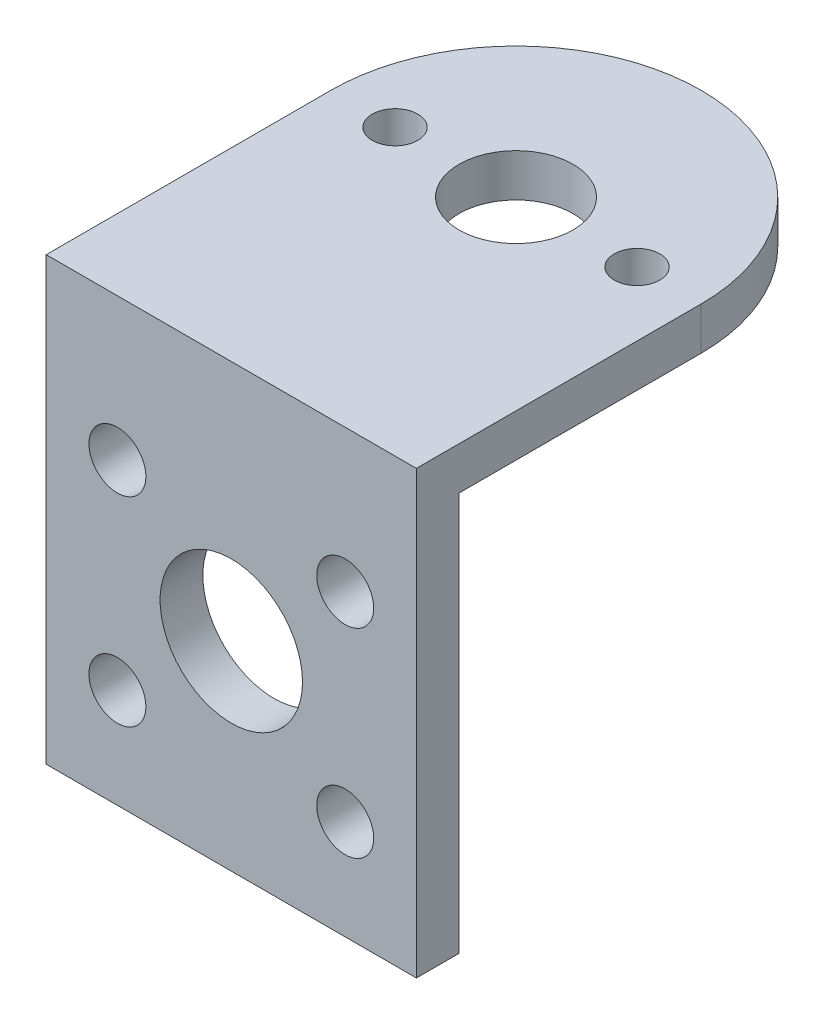
from build123d import *

# Parameters (mm, degrees)
SKETCH_1_R      = 4
SKETCH_1_R_2    = 1.6
EXTRUDE_1_DEPTH = 3
SKETCH_3_W      = 26
SKETCH_3_H      = 31
SKETCH_3_R      = 5
SKETCH_3_R_2    = 2
EXTRUDE_2_DEPTH = 3


with BuildPart() as part:
    # 草图1 → 凸台-拉伸1 (new body)
    with BuildSketch(Plane(origin=(0, 0, 0), x_dir=(1, 0, 0), z_dir=(0, 1, 0))):
        with BuildLine():
            Line((-13, 0), (-13, -20))
            Line((-13, -20), (13, -20))
            Line((13, -20), (13, 0))
            ThreePointArc((13, 0), (0, 13), (-13, 0))
        make_face()
        with Locations(Location((0, 0, 0), (0, 0, 270))):
            Circle(SKETCH_1_R, mode=Mode.SUBTRACT)
        with Locations(Location((-8.5, 0, 0), (0, 0, 270))):
            Circle(SKETCH_1_R_2, mode=Mode.SUBTRACT)
        with Locations(Location((8.5, 0, 0), (0, 0, 270))):
            Circle(SKETCH_1_R_2, mode=Mode.SUBTRACT)
    extrude(amount=EXTRUDE_1_DEPTH)

    # 草图3 → 凸台-拉伸2 (add)
    with BuildSketch(Plane.XY.offset(20)):
        with Locations((0, -12.5)):
            Rectangle(SKETCH_3_W, SKETCH_3_H)
        with Locations((0, -14)):
            Circle(SKETCH_3_R, mode=Mode.SUBTRACT)
        with Locations((-8, -7)):
            Circle(SKETCH_3_R_2, mode=Mode.SUBTRACT)
        with Locations((8, -7)):
            Circle(SKETCH_3_R_2, mode=Mode.SUBTRACT)
        with Locations((8, -21)):
            Circle(SKETCH_3_R_2, mode=Mode.SUBTRACT)
        with Locations((-8, -21)):
            Circle(SKETCH_3_R_2, mode=Mode.SUBTRACT)
    extrude(amount=-EXTRUDE_2_DEPTH)


solid = part.part
